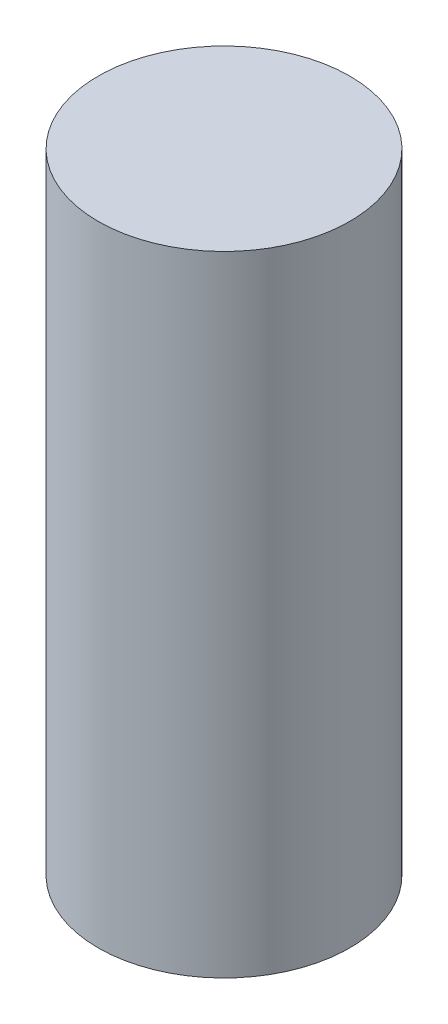
from build123d import *

# Parameters (mm, degrees)
SKETCH1_R           = 8
BOSS_EXTRUDE4_DEPTH = 40


with BuildPart() as part:
    # Sketch1 → Boss-Extrude4 (new body)
    with BuildSketch(Plane(origin=(0, 0, 0), x_dir=(1, 0, 0), z_dir=(0, 1, 0))):
        with Locations(Location((-2.30841714, 1.646940883, 0), (0, 0, 270))):
            Circle(SKETCH1_R)
    extrude(amount=BOSS_EXTRUDE4_DEPTH)


solid = part.part
